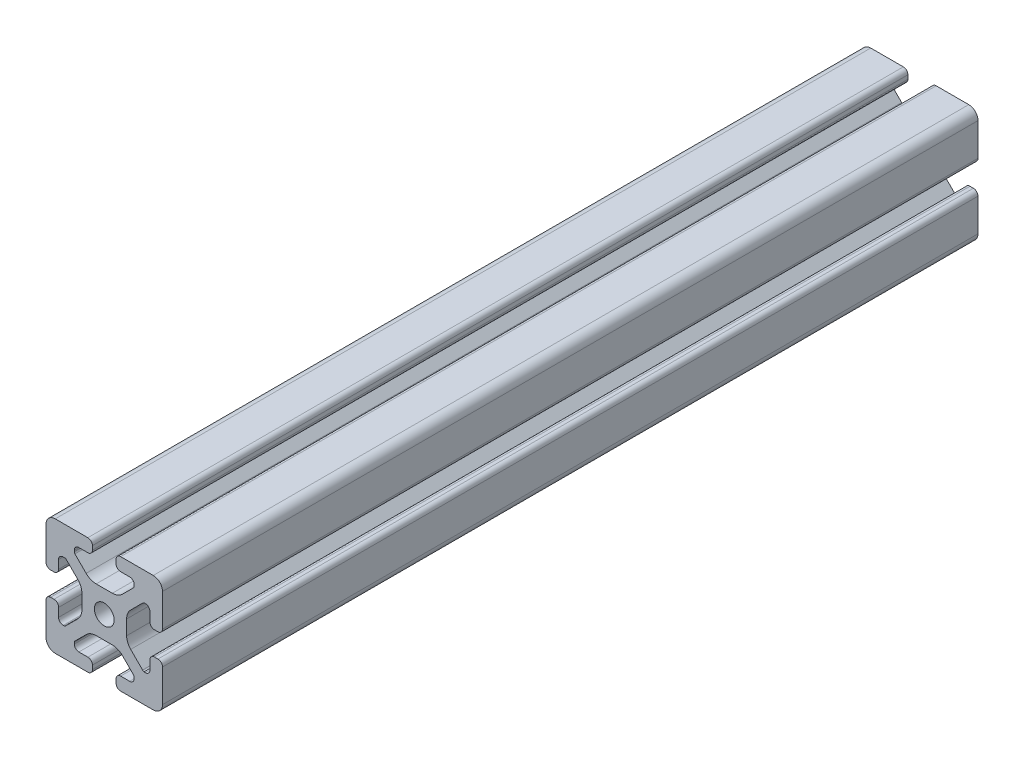
from build123d import *

# Parameters (mm, degrees)
SKETCH1_R      = 3.4
EXTRUDE1_DEPTH = 280


with BuildPart() as part:
    # Sketch1 → Extrude1 (new body)
    with BuildSketch(Plane.XY):
        with BuildLine():
            Line((-8.715, -15.524615034), (-5.63, -15.524615034))
            ThreePointArc((-5.63, -15.524615034), (-4.519842354, -15.984457388), (-4.06, -17.094615034))
            Line((-4.06, -17.094615034), (-4.06, -18.43))
            ThreePointArc((-4.06, -18.43), (-4.519842354, -19.540157646), (-5.63, -20))
            Line((-5.63, -20), (-16.674615034, -20))
            ThreePointArc((-16.674615034, -20), (-18.951578385, -19.194274381), (-20, -17.018368134))
            Line((-20, -17.018368134), (-20, -5.757918808))
            ThreePointArc((-20, -5.757918808), (-19.564709668, -4.603883664), (-18.43, -4.120449326))
            Line((-18.43, -4.120449326), (-17.25, -4.120449326))
            ThreePointArc((-17.25, -4.120449326), (-16.115287682, -4.60388249), (-15.67999625, -5.757919334))
            Line((-15.67999625, -5.757919334), (-15.67999625, -8.715399492))
            ThreePointArc((-15.67999625, -8.715399492), (-15.220153896, -9.825557139), (-14.10999625, -10.285399492))
            Line((-14.10999625, -10.285399492), (-13.816898819, -10.285399492))
            ThreePointArc((-13.816898819, -10.285399492), (-13.526061711, -10.227547119), (-13.279501941, -10.062800646))
            Line((-13.279501941, -10.062800646), (-9.076242789, -5.859541495))
            ThreePointArc((-9.076242789, -5.859541495), (-8.046572221, -4.318530588), (-7.685, -2.500784284))
            Line((-7.685, -2.500784284), (-7.685, 2.500784284))
            ThreePointArc((-7.685, 2.500784284), (-8.046572221, 4.318530588), (-9.076242789, 5.859541495))
            Line((-9.076242789, 5.859541495), (-13.040489136, 9.823787841))
            ThreePointArc((-13.040489136, 9.823787841), (-13.354224618, 10.012729352), (-13.71989919, 10.033001362))
            Line((-13.71989919, 10.033001362), (-14.05520779, 10.044710596))
            ThreePointArc((-14.05520779, 10.044710596), (-15.200613642, 9.605030484), (-15.68, 8.475666998))
            Line((-15.68, 8.475666998), (-15.68, 5.572979049))
            ThreePointArc((-15.68, 5.572979049), (-16.139842354, 4.462821403), (-17.25, 4.002979049))
            Line((-17.25, 4.002979049), (-18.43, 4.002979049))
            ThreePointArc((-18.43, 4.002979049), (-19.540157646, 4.462821403), (-20, 5.572979049))
            Line((-20, 5.572979049), (-20, 13.004526564))
            Line((-20, 13.004526564), (-20, 16.83))
            ThreePointArc((-20, 16.83), (-19.071528496, 19.071528496), (-16.83, 20))
            Line((-16.83, 20), (-5.63, 20))
            ThreePointArc((-5.63, 20), (-4.519842354, 19.540157646), (-4.06, 18.43))
            Line((-4.06, 18.43), (-4.06, 17.094615034))
            ThreePointArc((-4.06, 17.094615034), (-4.519842354, 15.984457388), (-5.63, 15.524615034))
            Line((-5.63, 15.524615034), (-8.715, 15.524615034))
            ThreePointArc((-8.715, 15.524615034), (-9.825157646, 15.06477268), (-10.285, 13.954615034))
            Line((-10.285, 13.954615034), (-10.285, 13.492503602))
            ThreePointArc((-10.285, 13.492503602), (-10.227148445, 13.201664194), (-10.062401154, 12.955102448))
            Line((-10.062401154, 12.955102448), (-6.217092793, 9.109794088))
            ThreePointArc((-6.217092793, 9.109794088), (-4.63891877, 8.055291919), (-2.777335583, 7.685))
            Line((-2.777335583, 7.685), (2.777335583, 7.685))
            ThreePointArc((2.777335583, 7.685), (4.63891877, 8.055291919), (6.217092793, 9.109794088))
            Line((6.217092793, 9.109794088), (10.062401154, 12.955102448))
            ThreePointArc((10.062401154, 12.955102448), (10.227148445, 13.201664194), (10.285, 13.492503602))
            Line((10.285, 13.492503602), (10.285, 13.954615034))
            ThreePointArc((10.285, 13.954615034), (9.825157646, 15.06477268), (8.715, 15.524615034))
            Line((8.715, 15.524615034), (5.63, 15.524615034))
            ThreePointArc((5.63, 15.524615034), (4.519842354, 15.984457388), (4.06, 17.094615034))
            Line((4.06, 17.094615034), (4.06, 18.43))
            ThreePointArc((4.06, 18.43), (4.519842354, 19.540157646), (5.63, 20))
            Line((5.63, 20), (12.979635074, 20))
            Line((12.979635074, 20), (16.83, 20))
            ThreePointArc((16.83, 20), (19.071528496, 19.071528496), (20, 16.83))
            Line((20, 16.83), (20, 13.001098436))
            Line((20, 13.001098436), (20, 5.63))
            ThreePointArc((20, 5.63), (19.540157461, 4.519842693), (18.43, 4.060000526))
            Line((18.43, 4.060000526), (17.24999625, 4.060000526))
            ThreePointArc((17.24999625, 4.060000526), (16.139838603, 4.519842879), (15.67999625, 5.630000526))
            Line((15.67999625, 5.630000526), (15.67999625, 8.715399492))
            ThreePointArc((15.67999625, 8.715399492), (15.220153896, 9.825557139), (14.10999625, 10.285399492))
            Line((14.10999625, 10.285399492), (13.816903094, 10.285399492))
            ThreePointArc((13.816903094, 10.285399492), (13.526063686, 10.227547937), (13.279501941, 10.062800646))
            Line((13.279501941, 10.062800646), (9.076242789, 5.859541495))
            ThreePointArc((9.076242789, 5.859541495), (8.046572221, 4.318530588), (7.685, 2.500784284))
            Line((7.685, 2.500784284), (7.685, -2.500784284))
            ThreePointArc((7.685, -2.500784284), (8.046572221, -4.318530588), (9.076242789, -5.859541495))
            Line((9.076242789, -5.859541495), (13.163657296, -9.946956002))
            ThreePointArc((13.163657296, -9.946956002), (13.35903797, -10.160433474), (13.6200547, -10.285399492))
            Line((13.6200547, -10.285399492), (14.10999625, -10.285399492))
            ThreePointArc((14.10999625, -10.285399492), (15.220153896, -9.825557139), (15.67999625, -8.715399492))
            Line((15.67999625, -8.715399492), (15.67999625, -5.630000526))
            ThreePointArc((15.67999625, -5.630000526), (16.139838603, -4.519842879), (17.24999625, -4.060000526))
            Line((17.24999625, -4.060000526), (18.43, -4.060000526))
            ThreePointArc((18.43, -4.060000526), (19.540157461, -4.519842693), (20, -5.63))
            Line((20, -5.63), (20, -16.83))
            ThreePointArc((20, -16.83), (19.071528496, -19.071528496), (16.83, -20))
            Line((16.83, -20), (13, -20))
            Line((13, -20), (5.63, -20))
            ThreePointArc((5.63, -20), (4.519842354, -19.540157646), (4.06, -18.43))
            Line((4.06, -18.43), (4.06, -17.094615034))
            ThreePointArc((4.06, -17.094615034), (4.519842354, -15.984457388), (5.63, -15.524615034))
            Line((5.63, -15.524615034), (8.715, -15.524615034))
            ThreePointArc((8.715, -15.524615034), (9.825157646, -15.06477268), (10.285, -13.954615034))
            Line((10.285, -13.954615034), (10.285, -13.492503602))
            ThreePointArc((10.285, -13.492503602), (10.227148445, -13.201664194), (10.062401154, -12.955102448))
            Line((10.062401154, -12.955102448), (6.217092793, -9.109794088))
            ThreePointArc((6.217092793, -9.109794088), (4.63891877, -8.055291919), (2.777335583, -7.685))
            Line((2.777335583, -7.685), (-2.777335583, -7.685))
            ThreePointArc((-2.777335583, -7.685), (-4.63891877, -8.055291919), (-6.217092793, -9.109794088))
            Line((-6.217092793, -9.109794088), (-10.062401154, -12.955102448))
            ThreePointArc((-10.062401154, -12.955102448), (-10.227148445, -13.201664194), (-10.285, -13.492503602))
            Line((-10.285, -13.492503602), (-10.285, -13.954615034))
            ThreePointArc((-10.285, -13.954615034), (-9.825157646, -15.06477268), (-8.715, -15.524615034))
        make_face()
        Circle(SKETCH1_R, mode=Mode.SUBTRACT)
    extrude(amount=-EXTRUDE1_DEPTH)


solid = part.part
